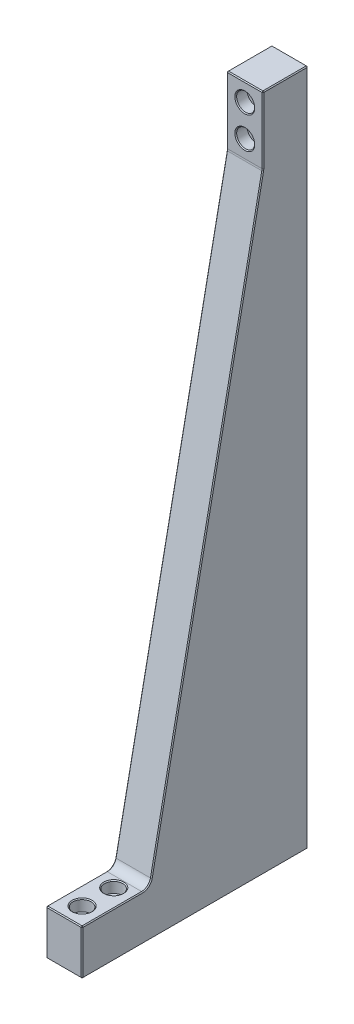
from build123d import *

# Parameters (mm, degrees)
BOSS_EXTRUDE1_DEPTH                                  = 20
CBORE_FOR_M12_HEX_SOCKET_HEAD_CAP_SCREW1_D           = 13.5
CBORE_FOR_M12_HEX_SOCKET_HEAD_CAP_SCREW1_CBORE_D     = 20
CBORE_FOR_M12_HEX_SOCKET_HEAD_CAP_SCREW1_CBORE_DEPTH = 12.6
CBORE_FOR_M12_HEX_SOCKET_HEAD_CAP_SCREW2_D           = 13.5
CBORE_FOR_M12_HEX_SOCKET_HEAD_CAP_SCREW2_CBORE_D     = 20
CBORE_FOR_M12_HEX_SOCKET_HEAD_CAP_SCREW2_CBORE_DEPTH = 12.6
FILLET1_R                                            = 10
CHAMFER1_SIZE                                        = 1
CHAMFER2_SIZE                                        = 1


with BuildPart() as part:
    # Sketch1 → Boss-Extrude1 (new, symmetric)
    with BuildSketch(Plane(origin=(0, 0, 0), x_dir=(0, 0, -1), z_dir=(1, 0, 0))):
        Polygon((0, 0), (250, 0), (250, 750), (200, 750), (200, 675), (75, 50), (0, 50), align=None)
    extrude(amount=BOSS_EXTRUDE1_DEPTH, both=True)

    # CBORE for M12 Hex Socket Head Cap Screw1 (through all)
    with Locations(Plane(origin=(0, 50, 0), x_dir=(1, 0, 0), z_dir=(0, 1, 0))):
        with Locations((0, 55), (0, 20)):
            CounterBoreHole(CBORE_FOR_M12_HEX_SOCKET_HEAD_CAP_SCREW1_D / 2, CBORE_FOR_M12_HEX_SOCKET_HEAD_CAP_SCREW1_CBORE_D / 2, CBORE_FOR_M12_HEX_SOCKET_HEAD_CAP_SCREW1_CBORE_DEPTH)

    # CBORE for M12 Hex Socket Head Cap Screw2 (through all)
    with Locations(Plane.XY.offset(-200)):
        with Locations((0, 730), (0, 695)):
            CounterBoreHole(CBORE_FOR_M12_HEX_SOCKET_HEAD_CAP_SCREW2_D / 2, CBORE_FOR_M12_HEX_SOCKET_HEAD_CAP_SCREW2_CBORE_D / 2, CBORE_FOR_M12_HEX_SOCKET_HEAD_CAP_SCREW2_CBORE_DEPTH)

    # Fillet1
    fillet1_edges = [part.edges().sort_by_distance(p)[0] for p in [
        (0, 50, -75),
        (0, 675, -200),
    ]]
    fillet(fillet1_edges, radius=FILLET1_R)

    # Chamfer1
    chamfer1_edges = [part.edges().sort_by_distance(p)[0] for p in [
        (-20, 25, 0),
        (0, 50, 0),
        (20, 375, -250),
        (0, 750, -200),
        (0, 750, -250),
        (0, 0, -250),
        (0, 0, 0),
        (20, 750, -225),
        (20, 712.995097568, -200),
        (6.75, 0, -20),
        (6.75, 0, -55),
        (6.75, 695, -250),
        (6.75, 730, -250),
        (20, 25, 0),
        (-20, 50, -33.400980486),
        (20, 50, -33.400980486),
        (-20, 366.033936217, -138.206787243),
        (20, 366.033936217, -138.206787243),
        (-20, 52.266578587, -73.141850029),
        (20, 52.266578587, -73.141850029),
        (-20, 675.004818956, -199.951333267),
        (20, 675.004818956, -199.951333267),
        (-20, 712.995097568, -200),
        (-20, 750, -225),
        (20, 0, -125),
        (-20, 375, -250),
        (-20, 0, -125),
    ]]
    chamfer(chamfer1_edges, length=CHAMFER1_SIZE)

    # Chamfer2
    chamfer2_edges = [part.edges().sort_by_distance(p)[0] for p in [
        (-10, 50, -20),
        (-10, 50, -55),
        (-10, 695, -200),
        (-10, 730, -200),
    ]]
    chamfer(chamfer2_edges, length=CHAMFER2_SIZE)


solid = part.part
